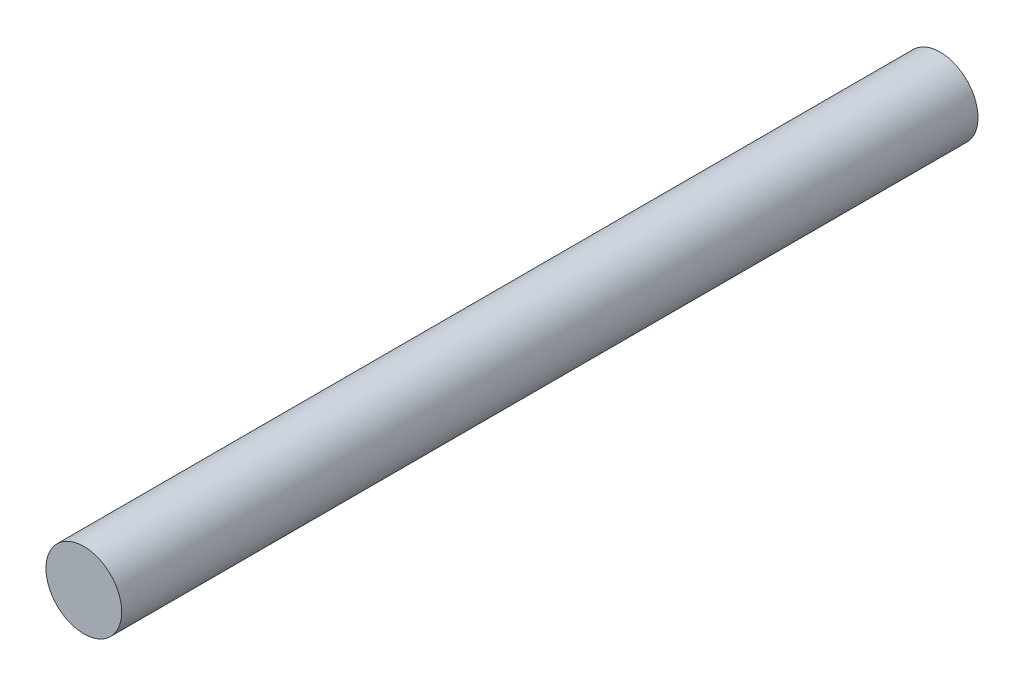
from build123d import *

# Parameters (mm, degrees)
SKETCH1_R           = 3.175
BOSS_EXTRUDE1_DEPTH = 71.7296


with BuildPart() as part:
    # Sketch1 → Boss-Extrude1 (new body)
    with BuildSketch(Plane.XY):
        Circle(SKETCH1_R)
    extrude(amount=BOSS_EXTRUDE1_DEPTH)


solid = part.part
